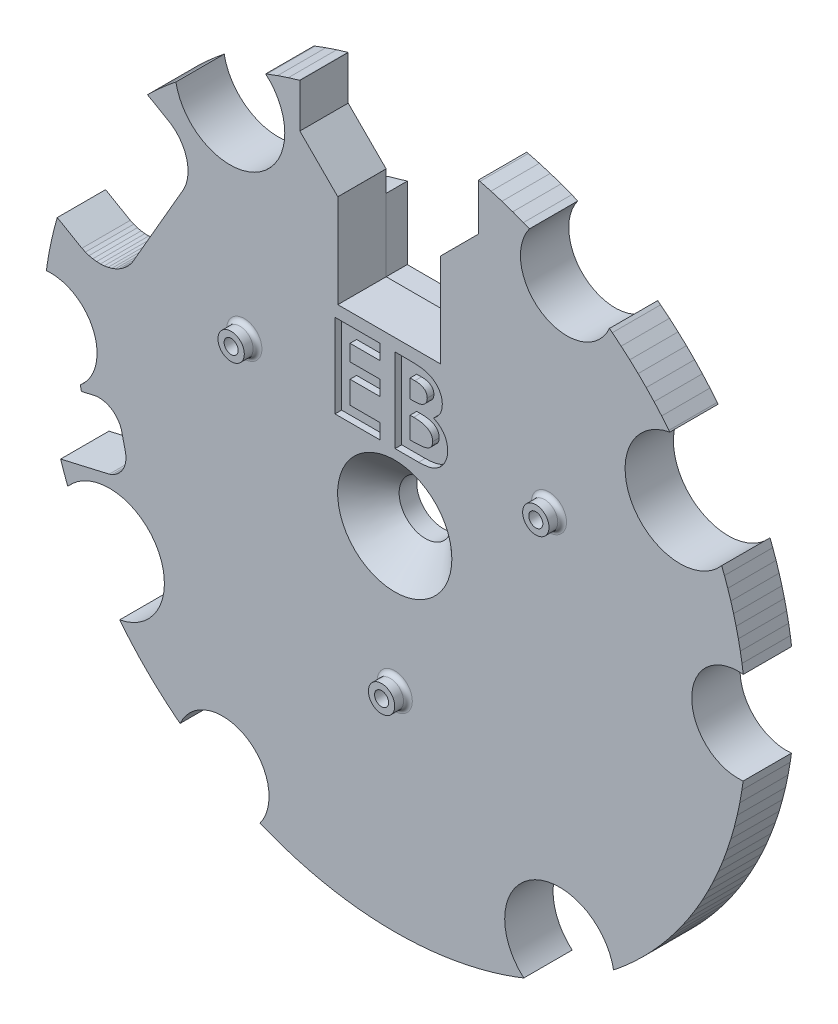
from build123d import *

# Parameters (mm, degrees)
DODANIE_WYCI_GNI_CIE1_DEPTH   = 5
DODANIE_WYCI_GNI_CIE1_2_DEPTH = 5
DODANIE_WYCI_GNI_CIE1_3_DEPTH = 5
DODANIE_WYCI_GNI_CIE1_4_DEPTH = 5
DODANIE_WYCI_GNI_CIE1_5_DEPTH = 5
DODANIE_WYCI_GNI_CIE1_6_DEPTH = 5
DODANIE_WYCI_GNI_CIE2_START   = 5
EB_R                          = 1.59999934
DODANIE_WYCI_GNI_CIE2_DEPTH   = 11
SZKIC5_R                      = 3
SZKIC5_R_2                    = 1.59999934
SZKIC5_R_3                    = 1.6
DODANIE_WYCI_GNI_CIE3_DEPTH   = 3
SZKIC6_R                      = 1.59999934
WYTNIJ_WYCI_GNI_CIE1_DEPTH    = 114.810772967
SZKIC7_R                      = 6
WYTNIJ_WYCI_GNI_CIE2_DEPTH    = 114.810772967
SFAZOWANIE1_SIZE              = 7
CUT_EXTRUDE2_DEPTH            = 1.5
FILLET1_R                     = 1


with BuildPart() as part:
    # mandaryna baza → Dodanie-wyciągnięcie1 (new body)
    with BuildSketch(Plane.XY):
        with BuildLine():
            Line((16.907164233, 3.25), (54.903893305, 3.25))
            ThreePointArc((54.903893305, 3.25), (47.631397208, 27.5), (30.266529215, 45.923166368))
            Line((30.266529215, 45.923166368), (11.268164679, 13.017033731))
            ThreePointArc((11.268164679, 13.017033731), (11.268164679, 6.50567791), (16.907164233, 3.25))
        make_face()
    extrude(amount=DODANIE_WYCI_GNI_CIE1_DEPTH)



with BuildPart() as body_2:
    # mandaryna baza → Dodanie-wyci_gni_cie1 2 (new body)
    with BuildSketch(Plane.XY):
        with BuildLine():
            Line((5.638999554, 16.267033731), (24.63736409, 49.173166368))
            ThreePointArc((24.63736409, 49.173166368), (17.789613857, 52.043535995), (10.61764744, 53.9654108))
            Line((10.61764744, 53.9654108), (10.61764744, 36.95114998))
            Line((10.61764744, 36.95114998), (-13.15035256, 36.95114998))
            Line((-13.15035256, 36.95114998), (-13.15035256, 53.404758473))
            ThreePointArc((-13.15035256, 53.404758473), (-19.011956116, 51.609548774), (-24.63736409, 49.173166368))
            Line((-24.63736409, 49.173166368), (-5.638999554, 16.267033731))
            ThreePointArc((-5.638999554, 16.267033731), (0, 13.011355821), (5.638999554, 16.267033731))
        make_face()
    extrude(amount=DODANIE_WYCI_GNI_CIE1_2_DEPTH)


with BuildPart() as body_3:
    # mandaryna baza → Dodanie-wyci_gni_cie1 3 (new body)
    with BuildSketch(Plane.XY):
        with BuildLine():
            Line((-11.268164679, 13.017033731), (-30.266529215, 45.923166368))
            ThreePointArc((-30.266529215, 45.923166368), (-47.631397208, 27.5), (-54.903893305, 3.25))
            Line((-54.903893305, 3.25), (-16.907164233, 3.25))
            ThreePointArc((-16.907164233, 3.25), (-11.268164679, 6.50567791), (-11.268164679, 13.017033731))
        make_face()
    extrude(amount=DODANIE_WYCI_GNI_CIE1_3_DEPTH)


with BuildPart() as body_4:
    # mandaryna baza → Dodanie-wyci_gni_cie1 4 (new body)
    with BuildSketch(Plane.XY):
        with BuildLine():
            Line((-16.907164233, -3.25), (-54.903893305, -3.25))
            ThreePointArc((-54.903893305, -3.25), (-47.631397208, -27.5), (-30.266529215, -45.923166368))
            Line((-30.266529215, -45.923166368), (-11.268164679, -13.017033731))
            ThreePointArc((-11.268164679, -13.017033731), (-11.268164679, -6.50567791), (-16.907164233, -3.25))
        make_face()
    extrude(amount=DODANIE_WYCI_GNI_CIE1_4_DEPTH)


with BuildPart() as body_5:
    # mandaryna baza → Dodanie-wyci_gni_cie1 5 (new body)
    with BuildSketch(Plane.XY):
        with BuildLine():
            Line((-5.638999554, -16.267033731), (-24.63736409, -49.173166368))
            ThreePointArc((-24.63736409, -49.173166368), (0, -55), (24.63736409, -49.173166368))
            Line((24.63736409, -49.173166368), (5.638999554, -16.267033731))
            ThreePointArc((5.638999554, -16.267033731), (0, -13.011355821), (-5.638999554, -16.267033731))
        make_face()
    extrude(amount=DODANIE_WYCI_GNI_CIE1_5_DEPTH)


with BuildPart() as body_6:
    # mandaryna baza → Dodanie-wyci_gni_cie1 6 (new body)
    with BuildSketch(Plane.XY):
        with BuildLine():
            Line((11.268164679, -13.017033731), (30.266529215, -45.923166368))
            ThreePointArc((30.266529215, -45.923166368), (47.631397208, -27.5), (54.903893305, -3.25))
            Line((54.903893305, -3.25), (16.907164233, -3.25))
            ThreePointArc((16.907164233, -3.25), (11.268164679, -6.50567791), (11.268164679, -13.017033731))
        make_face()
    extrude(amount=DODANIE_WYCI_GNI_CIE1_6_DEPTH)


with BuildPart() as part_1:
    add(part.part)

    add(body_2.part)  # Dodanie-wyciągnięcie2 merges body 2

    add(body_3.part)  # Dodanie-wyciągnięcie2 merges body 3

    add(body_4.part)  # Dodanie-wyciągnięcie2 merges body 4

    add(body_5.part)  # Dodanie-wyciągnięcie2 merges body 5

    add(body_6.part)  # Dodanie-wyciągnięcie2 merges body 6
    # EB_ → Dodanie-wyciągnięcie2 (add)
    with BuildSketch(Plane.XY.offset(DODANIE_WYCI_GNI_CIE2_START)):
        with BuildLine():
            Line((-71.57962062, -7.983371532), (-71.312597874, -9.139973792))
            Line((-71.312597874, -9.139973792), (-68.53523504, -8.49876888))
            Line((-68.53523504, -8.49876888), (-68.19394794, -8.41997808))
            Line((-68.19394794, -8.41997808), (-67.49664428, -8.35283572))
            Line((-67.49664428, -8.35283572), (-66.79654408, -8.37728322))
            Line((-66.79654408, -8.37728322), (-66.10562344, -8.49290402))
            Line((-66.10562344, -8.49290402), (-65.43570352, -8.69771946))
            Line((-65.43570352, -8.69771946), (-64.79824988, -8.98822434))
            Line((-64.79824988, -8.98822434), (-64.20416928, -9.35944788))
            Line((-64.20416928, -9.35944788), (-63.66362426, -9.80504008))
            Line((-63.66362426, -9.80504008), (-63.1858655, -10.31737332))
            Line((-63.1858655, -10.31737332), (-62.77906926, -10.8876846))
            Line((-62.77906926, -10.8876846), (-62.45019006, -11.50621524))
            Line((-62.45019006, -11.50621524), (-62.20486162, -12.1623836))
            Line((-62.20486162, -12.1623836), (-62.1260632, -12.50366054))
            Line((-62.1260632, -12.50366054), (-61.33063934, -15.94903846))
            Line((-61.33063934, -15.94903846), (-61.25184854, -16.29032556))
            Line((-61.25184854, -16.29032556), (-61.18470618, -16.98762922))
            Line((-61.18470618, -16.98762922), (-61.20915368, -17.68772942))
            Line((-61.20915368, -17.68772942), (-61.32477448, -18.37865006))
            Line((-61.32477448, -18.37865006), (-61.52958738, -19.04856998))
            Line((-61.52958738, -19.04856998), (-61.82009226, -19.68602362))
            Line((-61.82009226, -19.68602362), (-62.1913158, -20.28010422))
            Line((-62.1913158, -20.28010422), (-62.63690546, -20.82064924))
            Line((-62.63690546, -20.82064924), (-63.14924124, -21.298408))
            Line((-63.14924124, -21.298408), (-63.71955252, -21.70520678))
            Line((-63.71955252, -21.70520678), (-64.33808062, -22.03408598))
            Line((-64.33808062, -22.03408598), (-64.99424644, -22.27941442))
            Line((-64.99424644, -22.27941442), (-65.33552338, -22.35820776))
            Line((-65.33552338, -22.35820776), (-76.05586516, -24.83318884))
            Line((-76.05586516, -24.83318884), (-75.54626496, -26.37281238))
            Line((-75.54626496, -26.37281238), (-74.65067366, -28.8104199))
            Line((-74.65067366, -28.8104199), (-74.417803039, -29.385834102))
            ThreePointArc((-74.417803039, -29.385834102), (-54.113072342, -31.273397893), (-62.609286236, -49.811448903))
            Line((-62.609286236, -49.811448903), (-61.8316772, -50.79288038))
            Line((-61.8316772, -50.79288038), (-60.00002478, -52.9440267))
            Line((-60.00002478, -52.9440267), (-58.09357698, -55.02916858))
            Line((-58.09357698, -55.02916858), (-56.11470362, -57.0457076))
            Line((-56.11470362, -57.0457076), (-54.06587612, -58.99113424))
            Line((-54.06587612, -58.99113424), (-51.94964972, -60.86301772))
            Line((-51.94964972, -60.86301772), (-49.7686584, -62.65902632))
            Line((-49.7686584, -62.65902632), (-48.854025047, -63.359525568))
            ThreePointArc((-48.854025047, -63.359525568), (-33.882392112, -58.494836786), (-30.664292357, -73.904535798))
            Line((-30.664292357, -73.904535798), (-30.33088422, -74.04802818))
            Line((-30.33088422, -74.04802818), (-27.69790498, -75.07262354))
            Line((-27.69790498, -75.07262354), (-25.03039952, -76.0036326))
            Line((-25.03039952, -76.0036326), (-22.33168762, -76.8398895))
            Line((-22.33168762, -76.8398895), (-19.60513732, -77.58035538))
            Line((-19.60513732, -77.58035538), (-16.8541446, -78.22410568))
            Line((-16.8541446, -78.22410568), (-14.082141, -78.77033776))
            Line((-14.082141, -78.77033776), (-11.29258346, -79.2183709))
            Line((-11.29258346, -79.2183709), (-8.4889467, -79.56764884))
            Line((-8.4889467, -79.56764884), (-5.6747283, -79.81773216))
            Line((-5.6747283, -79.81773216), (-2.85343346, -79.96831098))
            Line((-2.85343346, -79.96831098), (-0.02858516, -80.0191948))
            Line((-0.02858516, -80.0191948), (2.79630124, -79.97032774))
            Line((2.79630124, -79.97032774), (5.61770276, -79.82176568))
            Line((5.61770276, -79.82176568), (8.43209896, -79.5736915))
            Line((8.43209896, -79.5736915), (11.23598464, -79.22641762))
            Line((11.23598464, -79.22641762), (14.02586222, -78.78037838))
            Line((14.02586222, -78.78037838), (16.79825444, -78.23612496))
            Line((16.79825444, -78.23612496), (19.54970436, -77.59434062))
            Line((19.54970436, -77.59434062), (22.27678552, -76.85582292))
            Line((22.27678552, -76.85582292), (24.97609178, -76.02149388))
            Line((24.97609178, -76.02149388), (27.64426526, -75.09239236))
            Line((27.64426526, -75.09239236), (29.384476808, -74.416637255))
            ThreePointArc((29.384476808, -74.416637255), (31.276596816, -54.111223602), (49.812489526, -62.614788922))
            Line((49.812489526, -62.614788922), (50.20371976, -62.31071104))
            Line((50.20371976, -62.31071104), (52.35361386, -60.51559398))
            Line((52.35361386, -60.51559398), (54.43937042, -58.6463394))
            Line((54.43937042, -58.6463394), (56.45843166, -56.7052333))
            Line((56.45843166, -56.7052333), (58.40832616, -54.6946582))
            Line((58.40832616, -54.6946582), (60.28666124, -52.61707536))
            Line((60.28666124, -52.61707536), (62.0911382, -50.47502986))
            Line((62.0911382, -50.47502986), (63.8195447, -48.27114806))
            Line((63.8195447, -48.27114806), (65.46976746, -46.0081249))
            Line((65.46976746, -46.0081249), (67.03977956, -43.68873914))
            Line((67.03977956, -43.68873914), (68.52766076, -41.31582796))
            Line((68.52766076, -41.31582796), (69.93158734, -38.89229966))
            Line((69.93158734, -38.89229966), (71.24983972, -36.42112604))
            Line((71.24983972, -36.42112604), (72.48080246, -33.9053297))
            Line((72.48080246, -33.9053297), (73.6229668, -31.34799674))
            Line((73.6229668, -31.34799674), (74.6749332, -28.75225644))
            Line((74.6749332, -28.75225644), (75.63541642, -26.12129396))
            Line((75.63541642, -26.12129396), (76.50323536, -23.45832748))
            Line((76.50323536, -23.45832748), (77.2773283, -20.76662344))
            Line((77.2773283, -20.76662344), (77.95674782, -18.04947622))
            Line((77.95674782, -18.04947622), (78.5406608, -15.31021576))
            Line((78.5406608, -15.31021576), (79.02835096, -12.55219994))
            Line((79.02835096, -12.55219994), (79.299411436, -10.628909904))
            ThreePointArc((79.299411436, -10.628909904), (67.599207973, -0.09719794), (79.333602634, 10.39640487))
            Line((79.333602634, 10.39640487), (79.04494478, 12.42009454))
            Line((79.04494478, 12.42009454), (78.6613108, 14.6546951))
            Line((78.6613108, 14.6546951), (78.21451972, 16.87752784))
            Line((78.21451972, 16.87752784), (77.70492714, 19.08680968))
            Line((77.70492714, 19.08680968), (77.13294454, 21.28076516))
            Line((77.13294454, 21.28076516), (76.49902912, 23.45763406))
            Line((76.49902912, 23.45763406), (75.80368888, 25.61566886))
            Line((75.80368888, 25.61566886), (75.0474877, 27.75313728))
            Line((75.0474877, 27.75313728), (74.417433184, 29.385403446))
            ThreePointArc((74.417433184, 29.385403446), (54.111310063, 31.276447161), (62.61564958, 49.812652056))
            Line((62.61564958, 49.812652056), (62.41427192, 50.07219348))
            Line((62.41427192, 50.07219348), (60.75485182, 52.07315976))
            Line((60.75485182, 52.07315976), (59.03130942, 54.01916806))
            Line((59.03130942, 54.01916806), (57.2454659, 55.90816352))
            Line((57.2454659, 55.90816352), (55.3992034, 57.73815224))
            Line((55.3992034, 57.73815224), (53.49447264, 59.50720382))
            Line((53.49447264, 59.50720382), (51.53328276, 61.21345136))
            Line((51.53328276, 61.21345136), (49.5177064, 62.855094))
            Line((49.5177064, 62.855094), (48.854412275, 63.360399614))
            ThreePointArc((48.854412275, 63.360399614), (33.885789996, 58.492867797), (30.660209654, 73.898975364))
            Line((30.660209654, 73.898975364), (29.29812276, 74.46063594))
            Line((29.29812276, 74.46063594), (26.86397218, 75.3730268))
            Line((26.86397218, 75.3730268), (24.40147012, 76.2058674))
            Line((24.40147012, 76.2058674), (21.913215, 76.95828144))
            Line((21.913215, 76.95828144), (19.40183064, 77.6294739))
            Line((19.40183064, 77.6294739), (19.04364746, 77.7128367))
            Line((19.04364746, 77.7128367), (19.04365, 67.0536505))
            Line((19.04365, 67.0536505), (10.41764998, 58.42765048))
            Line((10.41764998, 58.42765048), (10.41764998, 37.15114998))
            Line((10.41764998, 37.15114998), (-12.95035002, 37.15114998))
            Line((-12.95035002, 37.15114998), (-12.95035256, 58.4176505))
            Line((-12.95035256, 58.4176505), (-12.96035, 58.4176505))
            Line((-12.96035, 58.4176505), (-21.59635, 67.0536505))
            Line((-21.59635, 67.0536505), (-21.59635254, 77.04573364))
            Line((-21.59635254, 77.04573364), (-21.72109448, 77.01272888))
            Line((-21.72109448, 77.01272888), (-24.21122158, 76.26652768))
            Line((-24.21122158, 76.26652768), (-26.67579374, 75.43983134))
            Line((-26.67579374, 75.43983134), (-29.11221254, 74.5335187))
            Line((-29.11221254, 74.5335187), (-29.388740405, 74.420298138))
            ThreePointArc((-29.388740405, 74.420298138), (-31.275994816, 54.111571417), (-49.813273742, 62.618944704))
            Line((-49.813273742, 62.618944704), (-49.89862766, 62.55309562))
            Line((-49.89862766, 62.55309562), (-51.90221522, 60.90092722))
            Line((-51.90221522, 60.90092722), (-53.85113436, 59.18461366))
            Line((-53.85113436, 59.18461366), (-55.74333022, 57.40595834))
            Line((-55.74333022, 57.40595834), (-56.27645844, 56.87119182))
            Line((-56.27645844, 56.87119182), (-51.51362062, 54.1213675))
            Line((-51.51362062, 54.1213675), (-51.13540192, 53.90299608))
            Line((-51.13540192, 53.90299608), (-50.4254008, 53.3942163))
            Line((-50.4254008, 53.3942163), (-49.76868634, 52.81829416))
            Line((-49.76868634, 52.81829416), (-49.17158314, 52.18077702))
            Line((-49.17158314, 52.18077702), (-48.6398443, 51.48780152))
            Line((-48.6398443, 51.48780152), (-48.17859046, 50.74604532))
            Line((-48.17859046, 50.74604532), (-47.79226154, 49.96264836))
            Line((-47.79226154, 49.96264836), (-47.48457864, 49.14515698))
            Line((-47.48457864, 49.14515698), (-47.25850594, 48.30144518))
            Line((-47.25850594, 48.30144518), (-47.11622022, 47.43963588))
            Line((-47.11622022, 47.43963588), (-47.05909308, 46.5680298))
            Line((-47.05909308, 46.5680298), (-47.08767062, 45.69502164))
            Line((-47.08767062, 45.69502164), (-47.2016836, 44.8290188))
            Line((-47.2016836, 44.8290188), (-47.40002966, 43.97836264))
            Line((-47.40002966, 43.97836264), (-47.68079872, 43.15124212))
            Line((-47.68079872, 43.15124212), (-48.04128822, 42.35562268))
            Line((-48.04128822, 42.35562268), (-48.2596571, 41.9773989))
            Line((-48.2596571, 41.9773989), (-59.43565202, 22.62000048))
            Line((-59.43565202, 22.62000048), (-59.65402598, 22.24177416))
            Line((-59.65402598, 22.24177416), (-60.16280576, 21.53177304))
            Line((-60.16280576, 21.53177304), (-60.7387279, 20.87506112))
            Line((-60.7387279, 20.87506112), (-61.37624758, 20.27795792))
            Line((-61.37624758, 20.27795792), (-62.06922054, 19.74622162))
            Line((-62.06922054, 19.74622162), (-62.81097928, 19.28496778))
            Line((-62.81097928, 19.28496778), (-63.5943737, 18.89863886))
            Line((-63.5943737, 18.89863886), (-64.41186508, 18.59095596))
            Line((-64.41186508, 18.59095596), (-65.25557688, 18.3648858))
            Line((-65.25557688, 18.3648858), (-66.11738618, 18.22260008))
            Line((-66.11738618, 18.22260008), (-66.98898972, 18.16547294))
            Line((-66.98898972, 18.16547294), (-67.86199788, 18.19405048))
            Line((-67.86199788, 18.19405048), (-68.72800072, 18.30806346))
            Line((-68.72800072, 18.30806346), (-69.57865688, 18.50640698))
            Line((-69.57865688, 18.50640698), (-70.4057774, 18.78717858))
            Line((-70.4057774, 18.78717858), (-71.2013943, 19.14766554))
            Line((-71.2013943, 19.14766554), (-71.57962062, 19.36603442))
            Line((-71.57962062, 19.36603442), (-76.81740034, 22.39006698))
            Line((-76.81740034, 22.39006698), (-76.88341494, 22.17438796))
            Line((-76.88341494, 22.17438796), (-77.56249156, 19.66782198))
            Line((-77.56249156, 19.66782198), (-78.15986908, 17.14053976))
            Line((-78.15986908, 17.14053976), (-78.67492266, 14.59520068))
            Line((-78.67492266, 14.59520068), (-79.1071062, 12.03449206))
            Line((-79.1071062, 12.03449206), (-79.289748918, 10.687222926))
            ThreePointArc((-79.289748918, 10.687222926), (-68.55606183, 4.192492209), (-71.57962062, -7.983371532))
        make_face()
        with Locations((0, -32.5400162)):
            Circle(EB_R, mode=Mode.SUBTRACT)
        with Locations((35.10868772, 20.27001026)):
            Circle(EB_R, mode=Mode.SUBTRACT)
        with Locations((-34.24266202, 19.77001126)):
            Circle(EB_R, mode=Mode.SUBTRACT)
    extrude(amount=DODANIE_WYCI_GNI_CIE2_DEPTH)

    # Szkic5 → Dodanie-wyciągnięcie3 (add)
    # profile 1 of 3: a face of its own
    with BuildSketch(Plane.XY.offset(16)):
        with Locations((-34.24266202, 19.77001126)):
            Circle(SZKIC5_R)
        with Locations((-34.24266202, 19.77001126)):
            Circle(SZKIC5_R_2, mode=Mode.SUBTRACT)
    # profile 2 of 3: a face of its own
    with BuildSketch(Plane.XY.offset(16)):
        with Locations((35.10868772, 20.27001026)):
            Circle(SZKIC5_R)
        with Locations((35.10868772, 20.27001026)):
            Circle(SZKIC5_R_2, mode=Mode.SUBTRACT)
    # profile 3 of 3: a face of its own
    with BuildSketch(Plane.XY.offset(16)):
        with Locations((0, -32.5400162)):
            Circle(SZKIC5_R)
        with Locations((0, -32.5400162)):
            Circle(SZKIC5_R_3, mode=Mode.SUBTRACT)
    extrude(amount=DODANIE_WYCI_GNI_CIE3_DEPTH)

    # Szkic6 → Wytnij-wyciągnięcie1 (cut, through all)
    with BuildSketch(Plane.XY.offset(16)):
        with Locations((0, -32.5400162)):
            Circle(SZKIC6_R)
        with Locations((35.10868772, 20.27001026)):
            Circle(SZKIC6_R)
        with Locations((-34.24266202, 19.77001126)):
            Circle(SZKIC6_R)
    extrude(amount=-WYTNIJ_WYCI_GNI_CIE1_DEPTH, mode=Mode.SUBTRACT)

    # Szkic7 → Wytnij-wyciągnięcie2 (cut, through all)
    with BuildSketch(Plane.XY.offset(16)):
        Circle(SZKIC7_R)
    extrude(amount=-WYTNIJ_WYCI_GNI_CIE2_DEPTH, mode=Mode.SUBTRACT)

    # Sfazowanie1
    sfazowanie1_edges = [part_1.edges().sort_by_distance(p)[0] for p in [
        (-6, 0, 16),
    ]]
    chamfer(sfazowanie1_edges, length=SFAZOWANIE1_SIZE)

    # Sketch2 → Cut-Extrude2 (cut)
    # profile 1 of 2: a face of its own
    with BuildSketch(Plane.XY.offset(16)):
        Polygon((-13.600003866, 34.337145023), (-3.342311558, 34.337145023), (-3.342311558, 30.917914253), (-10.180773097, 30.917914253), (-10.180773097, 27.254452715), (-3.342311558, 27.254452715), (-3.342311558, 23.835221946), (-10.180773097, 23.835221946), (-10.180773097, 18.706375792), (-3.342311558, 18.706375792), (-3.342311558, 15.287145023), (-13.600003866, 15.287145023), align=None)
    # profile 2 of 2: a face of its own
    with BuildSketch(Plane.XY.offset(16)):
        with BuildLine():
            Line((0.076919211, 15.287145023), (0.076919211, 34.337145023))
            Line((0.076919211, 34.337145023), (3.129803826, 34.337145023))
            add(Edge.make_bspline(
                [(3.129803826, 34.337145023), (3.343524838, 34.337169414), (3.757070944, 34.337216609), (4.35371005, 34.316264603), (4.907042433, 34.289160835), (5.415307174, 34.258838022), (5.879369377, 34.206585756), (6.298523358, 34.151517576), (6.67360659, 34.085108744), (6.905500171, 34.025537965), (7.014599499, 33.997511609)],
                knots=[0, 0, 0, 0, 1.311965854, 2.538629056, 3.664479157, 4.713267157, 5.663616078, 6.530575999, 7.308677837, 8, 8, 8, 8], degree=3))
            add(Edge.make_bspline(
                [(7.014599499, 33.997511609), (7.157857994, 33.957979935), (7.438977152, 33.880406099), (7.841629496, 33.723742386), (8.223601412, 33.549599561), (8.584426522, 33.350935168), (8.921889216, 33.125350771), (9.23470702, 32.871056063), (9.529626642, 32.598258425), (9.796176157, 32.299355062), (10.037093002, 31.98350829), (10.246406546, 31.65080087), (10.428273188, 31.306320116), (10.573814138, 30.945730966), (10.68347651, 30.57069403), (10.763683111, 30.182810775), (10.815667849, 29.780853842), (10.820579725, 29.507389403), (10.823073057, 29.368575311)],
                knots=[0, 0, 0, 0, 1.099996261, 2.158545794, 3.195537121, 4.207578794, 5.205712374, 6.197378256, 7.190519799, 8.17788031, 9.159561366, 10.129234751, 11.085776129, 12.040971148, 13.00380137, 13.975669004, 14.972423361, 16, 16, 16, 16], degree=3))
            add(Edge.make_bspline(
                [(10.823073057, 29.368575311), (10.816553735, 29.190235639), (10.80372125, 28.839195907), (10.721746465, 28.323582052), (10.56803097, 27.836252847), (10.366897984, 27.368227001), (10.093420006, 26.921250252), (9.746155864, 26.495535125), (9.330730101, 26.077973214), (9.012075608, 25.827673015), (8.846330268, 25.697481561)],
                knots=[0, 0, 0, 0, 0.986156485, 1.941127874, 2.875419072, 3.804401753, 4.751181392, 5.761612777, 6.835722519, 8, 8, 8, 8], degree=3))
            add(Edge.make_bspline(
                [(8.846330268, 25.697481561), (8.98064234, 25.628916413), (9.243991153, 25.494479128), (9.617869101, 25.273504363), (9.964039268, 25.038469674), (10.284053777, 24.794104055), (10.571199958, 24.530048493), (10.837334558, 24.261518232), (11.069327877, 23.973127604), (11.276783295, 23.675155401), (11.457100173, 23.363286951), (11.61413629, 23.038048929), (11.746779065, 22.698330252), (11.859104398, 22.345859811), (11.942876661, 21.979425275), (11.997497958, 21.598895591), (12.039319437, 21.205568558), (12.042572755, 20.937644005), (12.044226903, 20.801417859)],
                knots=[0, 0, 0, 0, 1.164658916, 2.283573913, 3.35186032, 4.395461096, 5.390182219, 6.362969632, 7.312859996, 8.245001507, 9.165155236, 10.092416118, 11.032087915, 11.979892451, 12.947605196, 13.931445124, 14.948243989, 16, 16, 16, 16], degree=3))
            add(Edge.make_bspline(
                [(12.044226903, 20.801417859), (12.033492585, 20.541233709), (12.012308452, 20.027761333), (11.857420409, 19.273865957), (11.588893758, 18.559104762), (11.228317837, 17.886318516), (10.784018927, 17.274983275), (10.27320259, 16.739458912), (9.701011577, 16.286149427), (9.173096209, 15.980200691), (8.71649099, 15.774880479), (8.338293417, 15.647938577), (7.932117241, 15.53033979), (7.490522289, 15.447759494), (7.021514075, 15.372172926), (6.52051974, 15.325504214), (5.988475633, 15.293877977), (5.623044742, 15.289434715), (5.434731711, 15.287145023)],
                knots=[0, 0, 0, 0, 1.284142165, 2.534249414, 3.780121997, 5.041676246, 6.291546858, 7.49970053, 8.684500223, 9.883330709, 10.50184324, 11.153274765, 11.851151195, 12.587658647, 13.369265475, 14.195992086, 15.070362669, 16, 16, 16, 16], degree=3))
            Line((5.434731711, 15.287145023), (0.076919211, 15.287145023))
        make_face()
        with BuildLine():
            Line((3.49614998, 30.917914253), (3.49614998, 26.765991176))
            Line((3.49614998, 26.765991176), (4.404383153, 26.765991176))
            add(Edge.make_bspline(
                [(4.404383153, 26.765991176), (4.527820201, 26.767067594), (4.766107953, 26.769145554), (5.110289334, 26.795908949), (5.430322435, 26.841568963), (5.72499344, 26.905276169), (5.997047316, 26.986175031), (6.244746104, 27.083513786), (6.467000718, 27.202277646), (6.725209175, 27.379181658), (6.998154133, 27.63950383), (7.238424511, 28.015593145), (7.379942159, 28.448094426), (7.395703408, 28.753127819), (7.403842288, 28.910642619)],
                knots=[0, 0, 0, 0, 1.065314748, 2.056525647, 2.977365736, 3.853934255, 4.656397591, 5.425096493, 6.14721249, 6.826394842, 8.123232004, 9.372140726, 10.643011755, 12, 12, 12, 12], degree=3))
            add(Edge.make_bspline(
                [(7.403842288, 28.910642619), (7.397329694, 29.0581814), (7.384737856, 29.343441704), (7.24224778, 29.743972576), (7.020932522, 30.098924902), (6.759638752, 30.341860741), (6.513579895, 30.507778757), (6.302889202, 30.617028705), (6.071640345, 30.714828142), (5.815356595, 30.789607975), (5.535501471, 30.845720129), (5.233434388, 30.886927786), (4.908634175, 30.914975471), (4.684293976, 30.916913647), (4.568475701, 30.917914253)],
                knots=[0, 0, 0, 0, 1.347982417, 2.606269829, 3.849316587, 5.153353503, 5.842674298, 6.568177932, 7.326619318, 8.142485038, 9.012069166, 9.942760135, 10.937925643, 12, 12, 12, 12], degree=3))
            Line((4.568475701, 30.917914253), (3.49614998, 30.917914253))
        make_face(mode=Mode.SUBTRACT)
        with BuildLine():
            Line((3.49614998, 23.590991176), (3.49614998, 18.706375792))
            Line((3.49614998, 18.706375792), (4.480705268, 18.706375792))
            add(Edge.make_bspline(
                [(4.480705268, 18.706375792), (4.675353103, 18.707487808), (5.049587853, 18.709625797), (5.585678469, 18.735457791), (6.073118862, 18.782015409), (6.510617498, 18.840138844), (6.89884449, 18.918887008), (7.236487538, 19.019005206), (7.528176977, 19.129152662), (7.772163824, 19.265197848), (7.971487101, 19.423520708), (8.15135546, 19.585330473), (8.298008912, 19.771993326), (8.41404386, 19.975496345), (8.514471902, 20.19078437), (8.575043006, 20.426264321), (8.621159718, 20.674957136), (8.623697644, 20.846972578), (8.624996134, 20.934981561)],
                knots=[0, 0, 0, 0, 1.753078804, 3.370512758, 4.83203934, 6.162291463, 7.344201807, 8.395507345, 9.331626367, 10.147333109, 10.898971645, 11.62040215, 12.321813352, 13.025280112, 13.727906689, 14.453419512, 15.208716525, 16, 16, 16, 16], degree=3))
            add(Edge.make_bspline(
                [(8.624996134, 20.934981561), (8.622132591, 21.035621218), (8.61655518, 21.231640196), (8.571004399, 21.518142852), (8.488223748, 21.785612091), (8.383957481, 22.040887462), (8.238865429, 22.274829218), (8.066428485, 22.495533195), (7.858080635, 22.695525676), (7.623781324, 22.886902954), (7.350494374, 23.054464129), (7.038091567, 23.199853128), (6.684875761, 23.321276666), (6.289752834, 23.417954167), (5.854454972, 23.500003025), (5.375804981, 23.548995251), (4.857789222, 23.585432923), (4.498588665, 23.589096326), (4.312796615, 23.590991176)],
                knots=[0, 0, 0, 0, 0.845221588, 1.646264278, 2.427170338, 3.19324141, 3.95557735, 4.731569926, 5.540061037, 6.376114724, 7.268642756, 8.224665384, 9.265483498, 10.400594375, 11.639216012, 12.983232105, 14.439614077, 16, 16, 16, 16], degree=3))
            Line((4.312796615, 23.590991176), (3.49614998, 23.590991176))
        make_face(mode=Mode.SUBTRACT)
    extrude(amount=-CUT_EXTRUDE2_DEPTH, mode=Mode.SUBTRACT)

    # Fillet1
    fillet1_edges = [part_1.edges().sort_by_distance(p)[0] for p in [
        (-37.24266202, 19.77001126, 16),
        (32.10868772, 20.27001026, 16),
        (-3, -32.5400162, 16),
    ]]
    fillet(fillet1_edges, radius=FILLET1_R)


solid = part_1.part
